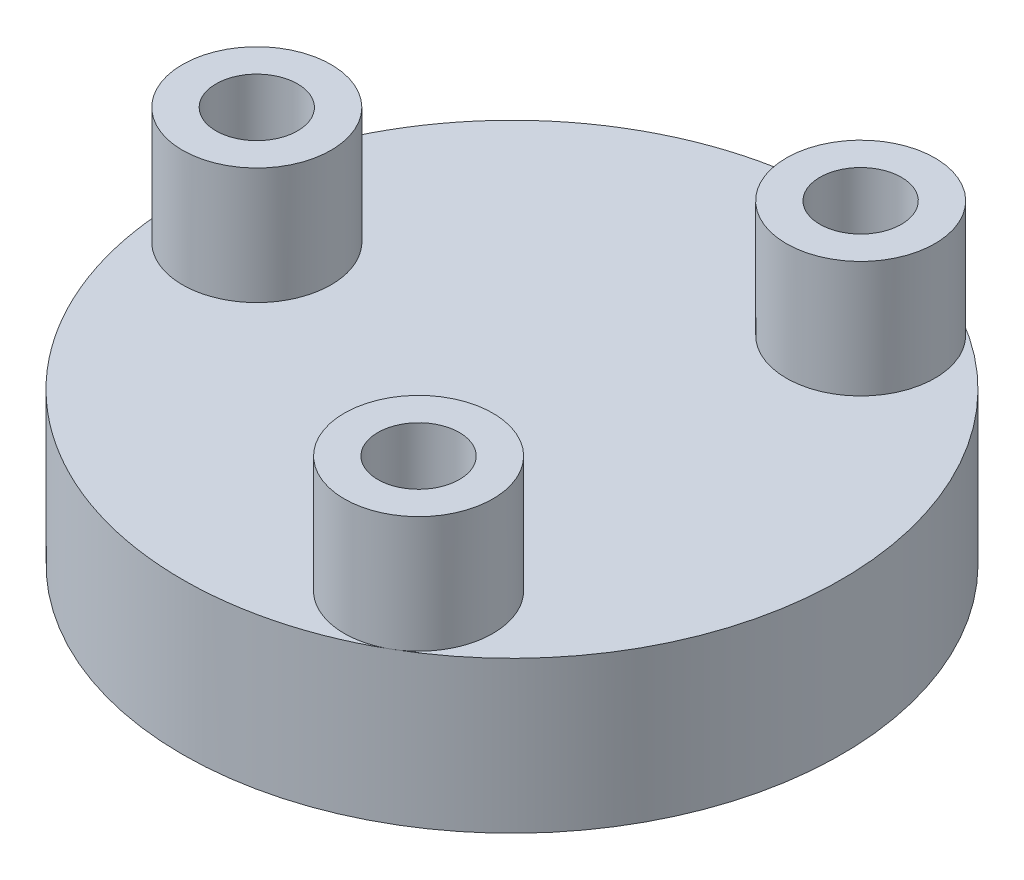
from build123d import *

# Parameters (mm, degrees)
SKETCH3_R           = 28.275
BOSS_EXTRUDE1_DEPTH = 13
SKETCH4_R           = 6.375
BOSS_EXTRUDE2_DEPTH = 10
D_GAGEMENT_M1_61_D  = 7


with BuildPart() as part:
    # Sketch3 → Boss-Extrude1 (new body)
    with BuildSketch(Plane(origin=(0, 0, 0), x_dir=(1, 0, 0), z_dir=(0, 1, 0))):
        with Locations(Location((0, 0, 0), (0, 0, 90))):
            Circle(SKETCH3_R)
    extrude(amount=BOSS_EXTRUDE1_DEPTH)

    # Sketch4 → Boss-Extrude2 (add)
    with BuildSketch(Plane(origin=(0, 13, 0), x_dir=(1, 0, 0), z_dir=(0, 1, 0))):
        with Locations(Location((-21.9, 0, 0), (0, 0, 179.999635348))):
            Circle(SKETCH4_R)
        with Locations(Location((10.95, 18.965956343, 0), (0, 0, 59.999635366))):
            Circle(SKETCH4_R)
        with Locations(Location((10.95, -18.965956343, 0), (0, 0, 299.999635366))):
            Circle(SKETCH4_R)
    extrude(amount=BOSS_EXTRUDE2_DEPTH)

    # Dégagement M1.61 (through all)
    with Locations(Plane(origin=(0, 0, 0), x_dir=(-1, 0, 0), z_dir=(0, -1, 0))):
        with Locations((21.9, 0), (-10.95, 18.965956343), (-10.95, -18.965956343)):
            Hole(D_GAGEMENT_M1_61_D / 2)


solid = part.part
